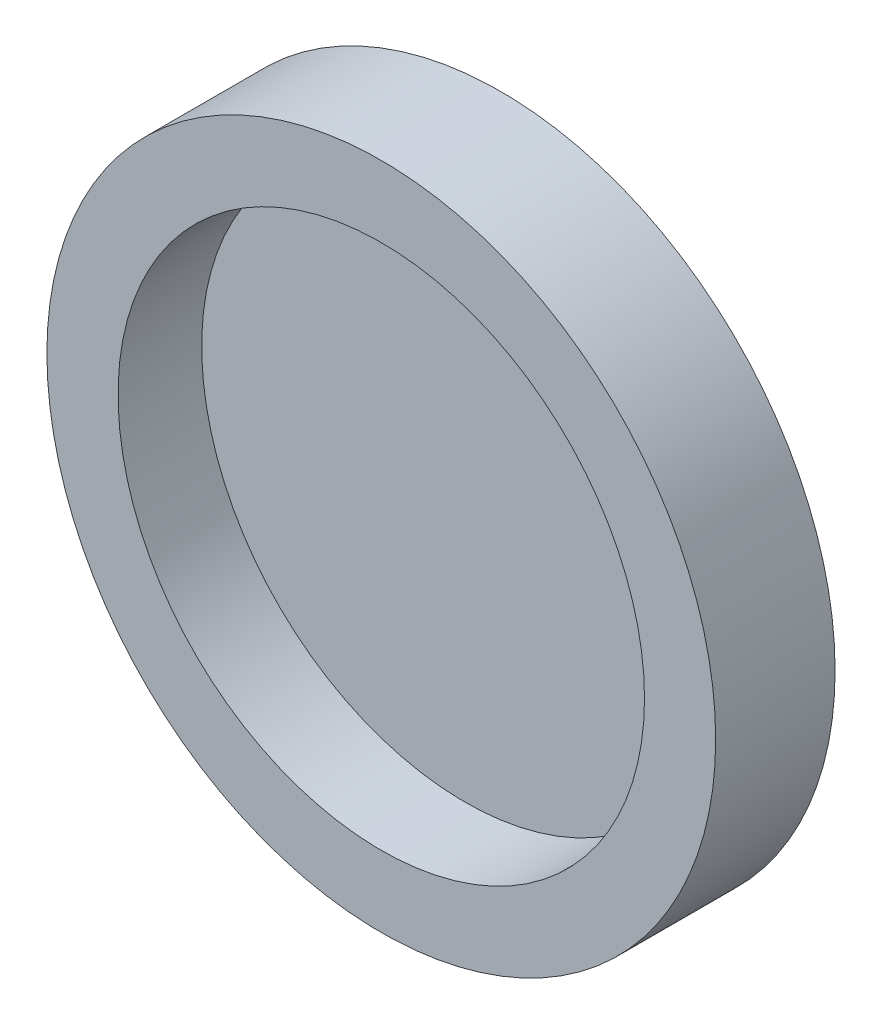
from build123d import *

# Parameters (mm, degrees)
SKETCH_1_R          = 14
EXTRUDE_1_DEPTH     = 5
SKETCH_2_R          = 11.02
CUT_EXTRUDE_1_DEPTH = 3.5


with BuildPart() as part:
    # 草图1 → 凸台-拉伸1 (new body)
    with BuildSketch(Plane.XY):
        Circle(SKETCH_1_R)
    extrude(amount=EXTRUDE_1_DEPTH)

    # 草图2 → 切除-拉伸1 (cut)
    with BuildSketch(Plane.XY.offset(5)):
        Circle(SKETCH_2_R)
    extrude(amount=-CUT_EXTRUDE_1_DEPTH, mode=Mode.SUBTRACT)


solid = part.part
